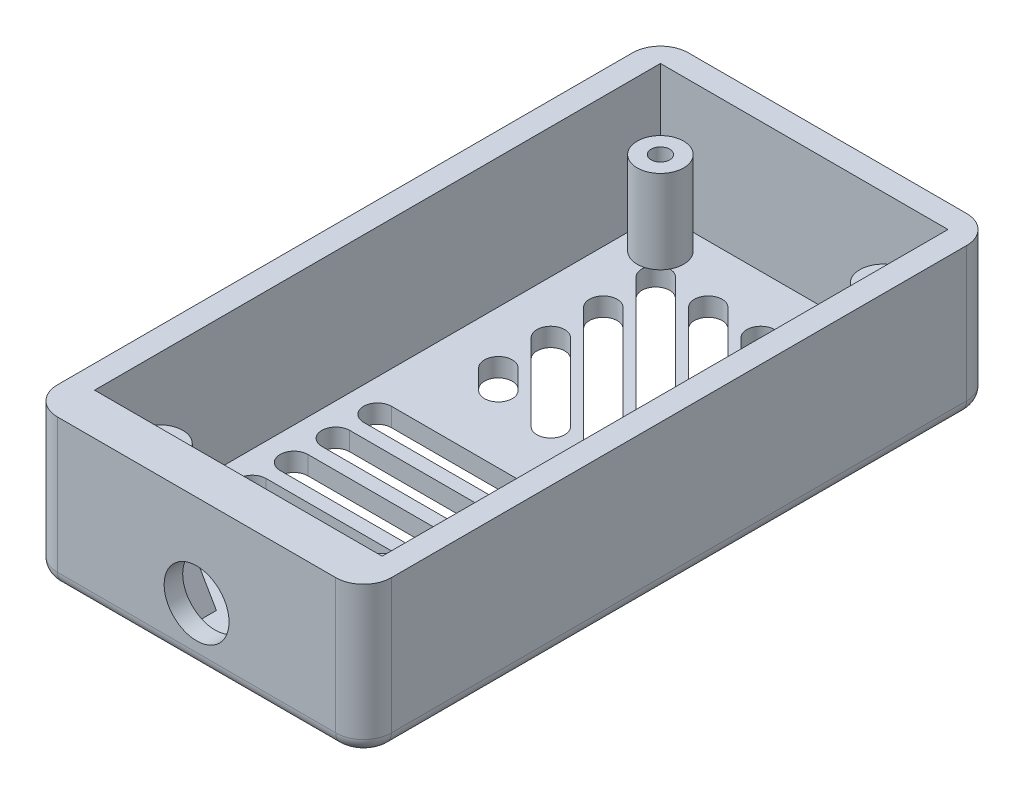
from build123d import *

# Parameters (mm, degrees)
SKETCH_1_W          = 36
SKETCH_1_H          = 66
SKETCH_1_W_2        = 30
SKETCH_1_H_2        = 60
SKETCH_1_R          = 1.05
EXTRUDE_1_DEPTH     = 16
SKETCH_2_W          = 31
SKETCH_2_H          = 61
CUT_EXTRUDE_1_DEPTH = 14
SKETCH_3_R          = 2.5
SKETCH_3_R_2        = 1
EXTRUDE_4_DEPTH     = 9
EXTRUDE_4_2_DEPTH   = 9
EXTRUDE_4_3_DEPTH   = 9
EXTRUDE_4_4_DEPTH   = 9
SKETCH_6_W          = 36
SKETCH_6_H          = 16
EXTRUDE_5_DEPTH     = 2
CUT_EXTRUDE_2_DEPTH = 2.5
SKETCH_9_R          = 3.5
CUT_EXTRUDE_3_DEPTH = 71.256672281
FILLET_1_R          = 3
FILLET_2_R          = 1.5
CUT_EXTRUDE_4_DEPTH = 2


with BuildPart() as part:
    # 草图1 → 凸台-拉伸1 (new body)
    # profile 1 of 6: a face of its own
    with BuildSketch(Plane(origin=(0, 0, 0), x_dir=(1, 0, 0), z_dir=(0, 1, 0))):
        Rectangle(SKETCH_1_W, SKETCH_1_H)
        Rectangle(SKETCH_1_W_2, SKETCH_1_H_2, mode=Mode.SUBTRACT)
    # profile 2 of 6: a face of its own
    with BuildSketch(Plane(origin=(0, 0, 0), x_dir=(1, 0, 0), z_dir=(0, 1, 0))):
        Rectangle(SKETCH_1_W_2, SKETCH_1_H_2)
        with Locations((12, 27)):
            Circle(SKETCH_1_R, mode=Mode.SUBTRACT)
        with Locations((-12, 27)):
            Circle(SKETCH_1_R, mode=Mode.SUBTRACT)
        with Locations((12, -27)):
            Circle(SKETCH_1_R, mode=Mode.SUBTRACT)
        with Locations((-12, -27)):
            Circle(SKETCH_1_R, mode=Mode.SUBTRACT)
    # profile 3 of 6: a face of its own
    with BuildSketch(Plane(origin=(0, 0, 0), x_dir=(1, 0, 0), z_dir=(0, 1, 0))):
        with Locations((-12, -27)):
            Circle(SKETCH_1_R)
    # profile 4 of 6: a face of its own
    with BuildSketch(Plane(origin=(0, 0, 0), x_dir=(1, 0, 0), z_dir=(0, 1, 0))):
        with Locations((12, -27)):
            Circle(SKETCH_1_R)
    # profile 5 of 6: a face of its own
    with BuildSketch(Plane(origin=(0, 0, 0), x_dir=(1, 0, 0), z_dir=(0, 1, 0))):
        with Locations((-12, 27)):
            Circle(SKETCH_1_R)
    # profile 6 of 6: a face of its own
    with BuildSketch(Plane(origin=(0, 0, 0), x_dir=(1, 0, 0), z_dir=(0, 1, 0))):
        with Locations((12, 27)):
            Circle(SKETCH_1_R)
    extrude(amount=EXTRUDE_1_DEPTH)

    # 草图2 → 切除-拉伸1 (cut)
    with BuildSketch(Plane(origin=(0, 16, 0), x_dir=(1, 0, 0), z_dir=(0, 1, 0))):
        Rectangle(SKETCH_2_W, SKETCH_2_H)
    extrude(amount=-CUT_EXTRUDE_1_DEPTH, mode=Mode.SUBTRACT)

    # 草图6 → 凸台-拉伸5 (add)
    with BuildSketch(Plane.XY.offset(33)):
        with Locations((0, 8)):
            Rectangle(SKETCH_6_W, SKETCH_6_H)
    extrude(amount=EXTRUDE_5_DEPTH)

    # 草图7 → 切除-拉伸2 (cut)
    with BuildSketch(Plane(origin=(0, 0, 30.5), x_dir=(-1, 0, 0), z_dir=(0, 0, -1))):
        Polygon((2.367136104, 10.2), (-2.367136104, 10.2), (-4.734272207, 6.1), (-2.367136104, 2), (2.367136104, 2), (4.734272207, 6.1), align=None)
    extrude(amount=-CUT_EXTRUDE_2_DEPTH, mode=Mode.SUBTRACT)

    # 草图9 → 切除-拉伸3 (cut, through all)
    with BuildSketch(Plane(origin=(0, 0, 33), x_dir=(-1, 0, 0), z_dir=(0, 0, -1))):
        with Locations((0, 6.1)):
            Circle(SKETCH_9_R)
    extrude(amount=-CUT_EXTRUDE_3_DEPTH, mode=Mode.SUBTRACT)

    # 圆角1
    fillet_1_edges = [part.edges().sort_by_distance(p)[0] for p in [
        (-18, 8, 35),
        (18, 8, 35),
        (-18, 8, -33),
        (18, 8, -33),
    ]]
    fillet(fillet_1_edges, radius=FILLET_1_R)

    # 圆角2
    fillet_2_edges = [part.edges().sort_by_distance(p)[0] for p in [
        (0, 0, 35),
        (-18, 0, 1),
        (0, 0, -33),
        (18, 0, 1),
        (-17.121320344, 0, -32.121320344),
        (17.121320344, 0, -32.121320344),
        (17.121320344, 0, 34.121320344),
        (-17.121320344, 0, 34.121320344),
    ]]
    fillet(fillet_2_edges, radius=FILLET_2_R)

    # 草图13 → 切除-拉伸4 (cut)
    with BuildSketch(Plane.XZ):
        with BuildLine():
            Line((-12, 18.5), (12, 18.5))
            ThreePointArc((12, 18.5), (13.5, 17), (12, 15.5))
            Line((12, 15.5), (-12, 15.5))
            ThreePointArc((-12, 15.5), (-13.5, 17), (-12, 18.5))
        make_face()
        with BuildLine():
            Line((-12, 14), (12, 14))
            ThreePointArc((12, 14), (13.5, 12.5), (12, 11))
            Line((12, 11), (-12, 11))
            ThreePointArc((-12, 11), (-13.5, 12.5), (-12, 14))
        make_face()
        with BuildLine():
            Line((-12, 9.5), (12, 9.5))
            ThreePointArc((12, 9.5), (13.5, 8), (12, 6.5))
            Line((12, 6.5), (-12, 6.5))
            ThreePointArc((-12, 6.5), (-13.5, 8), (-12, 9.5))
        make_face()
        with BuildLine():
            Line((-12, 5), (12, 5))
            ThreePointArc((12, 5), (13.5, 3.5), (12, 2))
            Line((12, 2), (-12, 2))
            ThreePointArc((-12, 2), (-13.5, 3.5), (-12, 5))
        make_face()
        with BuildLine():
            Line((-10.877605533, -6.285722441), (-8.75628519, -4.164402098))
            ThreePointArc((-8.75628519, -4.164402098), (-6.634964846, -4.164402098), (-6.634964846, -6.285722441))
            Line((-6.634964846, -6.285722441), (-8.75628519, -8.407042785))
            ThreePointArc((-8.75628519, -8.407042785), (-10.877605533, -8.407042785), (-10.877605533, -6.285722441))
        make_face()
        with BuildLine():
            Line((-10.877605533, -11.942576691), (-2.557423309, -3.622394467))
            ThreePointArc((-2.557423309, -3.622394467), (-0.436102966, -3.622394467), (-0.436102966, -5.74371481))
            Line((-0.436102966, -5.74371481), (-8.75628519, -14.063897034))
            ThreePointArc((-8.75628519, -14.063897034), (-10.877605533, -14.063897034), (-10.877605533, -11.942576691))
        make_face()
        with BuildLine():
            Line((-10.877605533, -17.59943094), (3.09943094, -3.622394467))
            ThreePointArc((3.09943094, -3.622394467), (5.220751284, -3.622394467), (5.220751284, -5.74371481))
            Line((5.220751284, -5.74371481), (-8.75628519, -19.720751284))
            ThreePointArc((-8.75628519, -19.720751284), (-10.877605533, -19.720751284), (-10.877605533, -17.59943094))
        make_face()
        with BuildLine():
            Line((-10.877605533, -23.25628519), (8.75628519, -3.622394467))
            ThreePointArc((8.75628519, -3.622394467), (10.877605533, -3.622394467), (10.877605533, -5.74371481))
            Line((10.877605533, -5.74371481), (-8.75628519, -25.377605533))
            ThreePointArc((-8.75628519, -25.377605533), (-10.877605533, -25.377605533), (-10.877605533, -23.25628519))
        make_face()
        with BuildLine():
            Line((8.214277559, -25.377605533), (10.335597902, -23.25628519))
            ThreePointArc((10.335597902, -23.25628519), (10.335597902, -21.134964846), (8.214277559, -21.134964846))
            Line((8.214277559, -21.134964846), (6.092957215, -23.25628519))
            ThreePointArc((6.092957215, -23.25628519), (6.092957215, -25.377605533), (8.214277559, -25.377605533))
        make_face()
        with BuildLine():
            Line((2.557423309, -25.377605533), (10.877605533, -17.057423309))
            ThreePointArc((10.877605533, -17.057423309), (10.877605533, -14.936102966), (8.75628519, -14.936102966))
            Line((8.75628519, -14.936102966), (0.436102966, -23.25628519))
            ThreePointArc((0.436102966, -23.25628519), (0.436102966, -25.377605533), (2.557423309, -25.377605533))
        make_face()
        with BuildLine():
            Line((-3.09943094, -25.377605533), (10.877605533, -11.40056906))
            ThreePointArc((10.877605533, -11.40056906), (10.877605533, -9.279248716), (8.75628519, -9.279248716))
            Line((8.75628519, -9.279248716), (-5.220751284, -23.25628519))
            ThreePointArc((-5.220751284, -23.25628519), (-5.220751284, -25.377605533), (-3.09943094, -25.377605533))
        make_face()
    extrude(amount=-CUT_EXTRUDE_4_DEPTH, mode=Mode.SUBTRACT)


with BuildPart() as body_2:
    # 草图3 → 凸台-拉伸4 (new body)
    with BuildSketch(Plane(origin=(0, 2, 0), x_dir=(1, 0, 0), z_dir=(0, 1, 0))):
        with Locations(Location((-12, 27, 0), (0, 0, 270))):
            Circle(SKETCH_3_R)
        with Locations(Location((-12, 27, 0), (0, 0, 270))):
            Circle(SKETCH_3_R_2, mode=Mode.SUBTRACT)
    extrude(amount=EXTRUDE_4_DEPTH)


with BuildPart() as body_3:
    # 草图3 → Extrude 4 2 (new body)
    with BuildSketch(Plane(origin=(0, 2, 0), x_dir=(1, 0, 0), z_dir=(0, 1, 0))):
        with Locations(Location((12, 27, 0), (0, 0, 270))):
            Circle(SKETCH_3_R)
        with Locations(Location((12, 27, 0), (0, 0, 270))):
            Circle(SKETCH_3_R_2, mode=Mode.SUBTRACT)
    extrude(amount=EXTRUDE_4_2_DEPTH)


with BuildPart() as body_4:
    # 草图3 → Extrude 4 3 (new body)
    with BuildSketch(Plane(origin=(0, 2, 0), x_dir=(1, 0, 0), z_dir=(0, 1, 0))):
        with Locations(Location((12, -27, 0), (0, 0, 270))):
            Circle(SKETCH_3_R)
        with Locations(Location((12, -27, 0), (0, 0, 270))):
            Circle(SKETCH_3_R_2, mode=Mode.SUBTRACT)
    extrude(amount=EXTRUDE_4_3_DEPTH)


with BuildPart() as body_5:
    # 草图3 → Extrude 4 4 (new body)
    with BuildSketch(Plane(origin=(0, 2, 0), x_dir=(1, 0, 0), z_dir=(0, 1, 0))):
        with Locations(Location((-12, -27, 0), (0, 0, 270))):
            Circle(SKETCH_3_R)
        with Locations(Location((-12, -27, 0), (0, 0, 270))):
            Circle(SKETCH_3_R_2, mode=Mode.SUBTRACT)
    extrude(amount=EXTRUDE_4_4_DEPTH)


solid = Compound([part.part, body_2.part, body_3.part, body_4.part, body_5.part])
